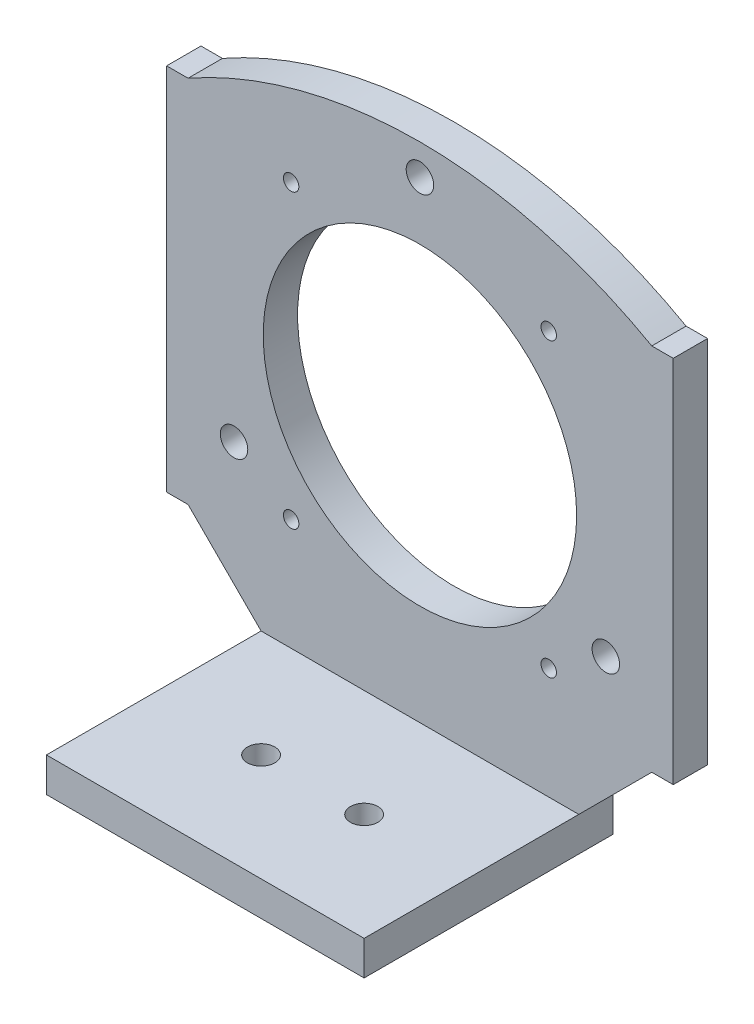
from build123d import *

# Parameters (mm, degrees)
SKETCH_1_R          = 18.25
SKETCH_1_R_2        = 1.6
SKETCH_1_R_3        = 0.9
EXTRUDE_1_DEPTH     = 4
SKETCH_2_W          = 37
SKETCH_2_H          = 4
EXTRUDE_2_DEPTH     = 25
SKETCH_3_R          = 1.6
CUT_EXTRUDE_1_DEPTH = 72.716563183


with BuildPart() as part:
    # 草图1 → 凸台-拉伸1 (new body)
    with BuildSketch(Plane.XY):
        with BuildLine():
            Line((-18.5, -34), (18.5, -34))
            Line((18.5, -34), (18.5, -30))
            Line((18.5, -30), (27, -21.5))
            Line((27, -21.5), (29.5, -21.5))
            Line((29.5, -21.5), (29.5, 21.5))
            Line((29.5, 21.5), (27, 21.5))
            ThreePointArc((27, 21.5), (0, 28.583405797), (-27, 21.5))
            Line((-27, 21.5), (-29.5, 21.5))
            Line((-29.5, 21.5), (-29.5, -21.5))
            Line((-29.5, -21.5), (-27, -21.5))
            Line((-27, -21.5), (-18.5, -30))
            Line((-18.5, -30), (-18.5, -34))
        make_face()
        Circle(SKETCH_1_R, mode=Mode.SUBTRACT)
        with Locations((0, 25)):
            Circle(SKETCH_1_R_2, mode=Mode.SUBTRACT)
        with Locations((21.650635095, -12.5)):
            Circle(SKETCH_1_R_2, mode=Mode.SUBTRACT)
        with Locations((-21.650635095, -12.5)):
            Circle(SKETCH_1_R_2, mode=Mode.SUBTRACT)
        with Locations((-15, 17)):
            Circle(SKETCH_1_R_3, mode=Mode.SUBTRACT)
        with Locations(Location((15, 17, 0), (0, 0, 180))):
            Circle(SKETCH_1_R_3, mode=Mode.SUBTRACT)
        with Locations((15, -17)):
            Circle(SKETCH_1_R_3, mode=Mode.SUBTRACT)
        with Locations(Location((-15, -17, 0), (0, 0, 180))):
            Circle(SKETCH_1_R_3, mode=Mode.SUBTRACT)
    extrude(amount=EXTRUDE_1_DEPTH)

    # 草图2 → 凸台-拉伸2 (add)
    with BuildSketch(Plane.XY.offset(4)):
        with Locations((0, -32)):
            Rectangle(SKETCH_2_W, SKETCH_2_H)
    extrude(amount=EXTRUDE_2_DEPTH)

    # 草图3 → 切除-拉伸1 (cut, through all)
    with BuildSketch(Plane(origin=(0, -30, 0), x_dir=(1, 0, 0), z_dir=(0, 1, 0))):
        with Locations(Location((-6, -16.5, 0), (0, 0, 180))):
            Circle(SKETCH_3_R)
        with Locations((6, -16.5)):
            Circle(SKETCH_3_R)
    extrude(amount=-CUT_EXTRUDE_1_DEPTH, mode=Mode.SUBTRACT)


solid = part.part
